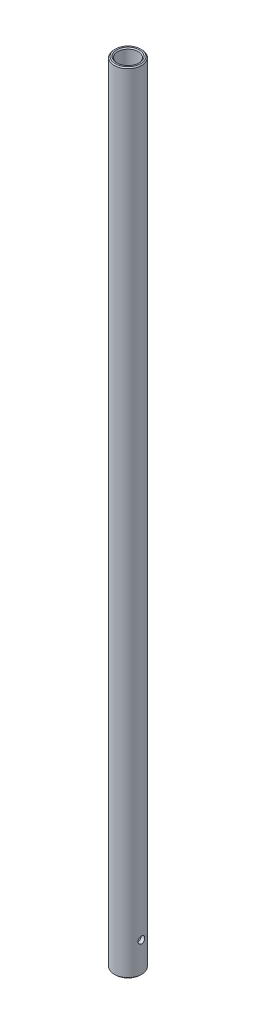
from build123d import *

# Parameters (mm, degrees)
SKETCH_1_R               = 4
SKETCH_1_R_2             = 3
EXTRUDE_1_DEPTH          = 230
CHAMFER_1_SIZE           = 0.3
CUT_EXTRUDE_1_DEPTH      = 231.0695547
CUT_EXTRUDE_1_DEPTH_BACK = 231.0695547
SKETCH_2_R               = 1


with BuildPart() as part:
    # Эскиз1 → Бобышка-Вытянуть1 (new body)
    with BuildSketch(Plane(origin=(0, 0, 0), x_dir=(1, 0, 0), z_dir=(0, 1, 0))):
        with Locations(Location((0, 0, 0), (0, 0, 270))):
            Circle(SKETCH_1_R)
        with Locations(Location((0, 0, 0), (0, 0, 270))):
            Circle(SKETCH_1_R_2, mode=Mode.SUBTRACT)
    extrude(amount=EXTRUDE_1_DEPTH)

    # Фаска1
    chamfer_1_edges = [part.edges().sort_by_distance(p)[0] for p in [
        (0, 0, -4),
        (0, 230, -4),
        (0, 0, -3),
        (0, 230, -3),
    ]]
    chamfer(chamfer_1_edges, length=CHAMFER_1_SIZE)

    # Эскиз2 → Вырез-Вытянуть1 (cut, two sides: drawn at the far end of the back side and taken through both)
    with BuildSketch(Plane(origin=(0, 0, 0), x_dir=(0, 0, -1), z_dir=(1, 0, 0)).offset(-CUT_EXTRUDE_1_DEPTH_BACK)):
        with Locations((0, 9)):
            Circle(SKETCH_2_R)
    extrude(amount=CUT_EXTRUDE_1_DEPTH + CUT_EXTRUDE_1_DEPTH_BACK, mode=Mode.SUBTRACT)


solid = part.part
